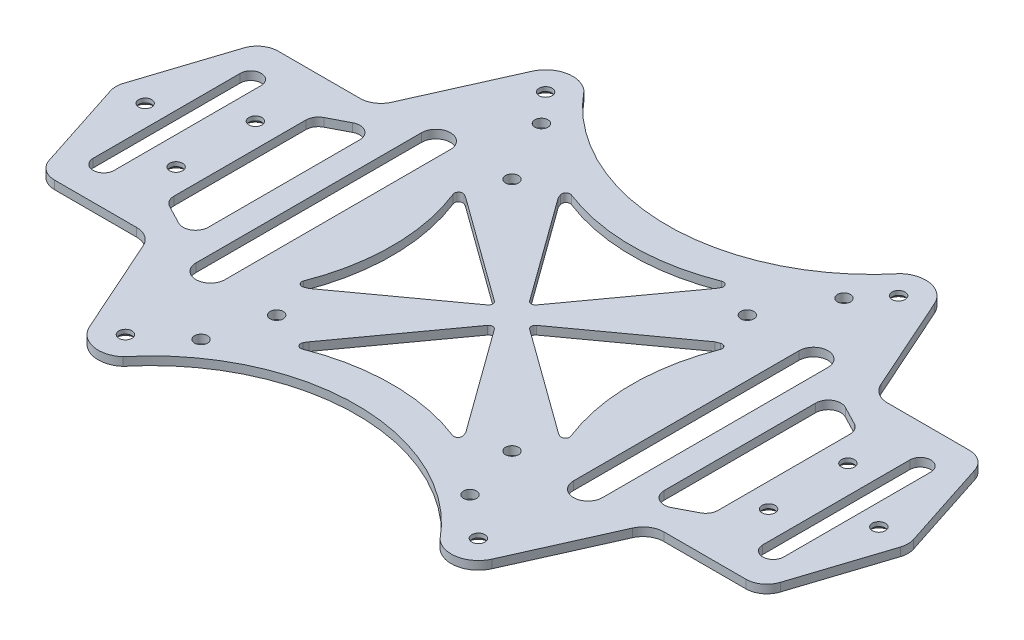
from build123d import *

# Parameters (mm, degrees)
SKETCH_1_R             = 1.55
EXTRUDE_1_DEPTH        = 2
CHAMFER_2_SIZE         = 1
CUT_EXTRUDE_4767_DEPTH = 111.105329369
FILLET_2_R             = 3
FILLET_3_R             = 5
FILLET_4_R             = 1


with BuildPart() as part:
    # 草图1 → 凸台-拉伸1 (new body)
    with BuildSketch(Plane(origin=(0, 0, 0), x_dir=(1, 0, 0), z_dir=(0, 1, 0))):
        with BuildLine():
            Line((47.899982554, 52.633397656), (59.52497064, 26.588251477))
            Line((59.52497064, 26.588251477), (85.869588061, 26.588251477))
            Line((85.869588061, 26.588251477), (94.505759306, 0))
            Line((94.505759306, 0), (85.869588061, -26.588251477))
            Line((85.869588061, -26.588251477), (59.52497064, -26.588251477))
            Line((59.52497064, -26.588251477), (47.899982554, -52.633397656))
            ThreePointArc((47.899982554, -52.633397656), (43.362068791, -56.315801292), (37.709796983, -54.831018053))
            ThreePointArc((37.709796983, -54.831018053), (0, -36.976547041), (-37.709796983, -54.831018053))
            ThreePointArc((-37.709796983, -54.831018053), (-43.362068791, -56.315801292), (-47.899982554, -52.633397656))
            Line((-47.899982554, -52.633397656), (-59.52497064, -26.588251477))
            Line((-59.52497064, -26.588251477), (-85.869588061, -26.588251477))
            Line((-85.869588061, -26.588251477), (-94.505759306, 0))
            Line((-94.505759306, 0), (-85.869588061, 26.588251477))
            Line((-85.869588061, 26.588251477), (-59.52497064, 26.588251477))
            Line((-59.52497064, 26.588251477), (-47.899982554, 52.633397656))
            ThreePointArc((-47.899982554, 52.633397656), (-43.362068791, 56.315801292), (-37.709796983, 54.831018053))
            ThreePointArc((-37.709796983, 54.831018053), (0, 36.976547041), (37.709796983, 54.831018053))
            ThreePointArc((37.709796983, 54.831018053), (43.362068791, 56.315801292), (47.899982554, 52.633397656))
        make_face()
        with Locations(Location((42, 50, 0), (0, 0, 270))):
            Circle(SKETCH_1_R, mode=Mode.SUBTRACT)
        with Locations(Location((42, -50, 0), (0, 0, 90))):
            Circle(SKETCH_1_R, mode=Mode.SUBTRACT)
        with Locations(Location((-42, -50, 0), (0, 0, 270))):
            Circle(SKETCH_1_R, mode=Mode.SUBTRACT)
        with Locations(Location((-42, 50, 0), (0, 0, 90))):
            Circle(SKETCH_1_R, mode=Mode.SUBTRACT)
        with Locations(Location((36, 43, 0), (0, 0, 270))):
            Circle(SKETCH_1_R, mode=Mode.SUBTRACT)
        with Locations(Location((32, -42, 0), (0, 0, 270))):
            Circle(SKETCH_1_R, mode=Mode.SUBTRACT)
        with Locations(Location((-32, -42, 0), (0, 0, 90))):
            Circle(SKETCH_1_R, mode=Mode.SUBTRACT)
        with Locations(Location((-36, 43, 0), (0, 0, 90))):
            Circle(SKETCH_1_R, mode=Mode.SUBTRACT)
        with Locations(Location((70.5, 9.435839055, 0), (0, 0, 270))):
            Circle(SKETCH_1_R, mode=Mode.SUBTRACT)
        with Locations(Location((70.5, -9.435839055, 0), (0, 0, 90))):
            Circle(SKETCH_1_R, mode=Mode.SUBTRACT)
        with Locations(Location((-70.5, -9.435839055, 0), (0, 0, 270))):
            Circle(SKETCH_1_R, mode=Mode.SUBTRACT)
        with Locations(Location((-70.5, 9.435839055, 0), (0, 0, 90))):
            Circle(SKETCH_1_R, mode=Mode.SUBTRACT)
        with Locations(Location((87.3, 0, 0), (0, 0, 270))):
            Circle(SKETCH_1_R, mode=Mode.SUBTRACT)
        with Locations(Location((-87.3, 0, 0), (0, 0, 90))):
            Circle(SKETCH_1_R, mode=Mode.SUBTRACT)
        with Locations(Location((28, 28, 0), (0, 0, 270))):
            Circle(SKETCH_1_R, mode=Mode.SUBTRACT)
        with Locations(Location((28, -28, 0), (0, 0, 270))):
            Circle(SKETCH_1_R, mode=Mode.SUBTRACT)
        with Locations(Location((-28, -28, 0), (0, 0, 270))):
            Circle(SKETCH_1_R, mode=Mode.SUBTRACT)
        with Locations(Location((-28, 28, 0), (0, 0, 270))):
            Circle(SKETCH_1_R, mode=Mode.SUBTRACT)
        with BuildLine():
            Line((77.169642998, -17.5), (77.169642998, 17.5))
            ThreePointArc((77.169642998, 17.5), (79.669642998, 20), (82.169642998, 17.5))
            Line((82.169642998, 17.5), (82.169642998, -17.5))
            ThreePointArc((82.169642998, -17.5), (79.669642998, -20), (77.169642998, -17.5))
        make_face(mode=Mode.SUBTRACT)
        with BuildLine():
            Line((-77.169642998, -17.5), (-77.169642998, 17.5))
            ThreePointArc((-77.169642998, 17.5), (-79.669642998, 20), (-82.169642998, 17.5))
            Line((-82.169642998, 17.5), (-82.169642998, -17.5))
            ThreePointArc((-82.169642998, -17.5), (-79.669642998, -20), (-77.169642998, -17.5))
        make_face(mode=Mode.SUBTRACT)
        with BuildLine():
            Line((-29.630231214, 18.644740495), (-3.891240241, 0))
            Line((-3.891240241, 0), (-29.630231214, -18.644740495))
            ThreePointArc((-29.630231214, -18.644740495), (-31.15278499, -19.235170637), (-32.699643644, -19.758626516))
            ThreePointArc((-32.699643644, -19.758626516), (-28.515989447, 0), (-32.699643644, 19.758626516))
            ThreePointArc((-32.699643644, 19.758626516), (-31.086798275, 19.417002923), (-29.630231214, 18.644740495))
        make_face(mode=Mode.SUBTRACT)
        with BuildLine():
            Line((18.644740495, 29.630231214), (0, 3.891240241))
            Line((0, 3.891240241), (-18.644740495, 29.630231214))
            ThreePointArc((-18.644740495, 29.630231214), (-19.235170637, 31.15278499), (-19.758626516, 32.699643644))
            ThreePointArc((-19.758626516, 32.699643644), (0, 28.515989447), (19.758626516, 32.699643644))
            ThreePointArc((19.758626516, 32.699643644), (19.417002923, 31.086798275), (18.644740495, 29.630231214))
        make_face(mode=Mode.SUBTRACT)
        with BuildLine():
            Line((29.630231214, -18.644740495), (3.891240241, 0))
            Line((3.891240241, 0), (29.630231214, 18.644740495))
            ThreePointArc((29.630231214, 18.644740495), (31.15278499, 19.235170637), (32.699643644, 19.758626516))
            ThreePointArc((32.699643644, 19.758626516), (28.515989447, 0), (32.699643644, -19.758626516))
            ThreePointArc((32.699643644, -19.758626516), (31.086798275, -19.417002923), (29.630231214, -18.644740495))
        make_face(mode=Mode.SUBTRACT)
        with BuildLine():
            Line((-18.644740495, -29.630231214), (0, -3.891240241))
            Line((0, -3.891240241), (18.644740495, -29.630231214))
            ThreePointArc((18.644740495, -29.630231214), (19.235170637, -31.15278499), (19.758626516, -32.699643644))
            ThreePointArc((19.758626516, -32.699643644), (0, -28.515989447), (-19.758626516, -32.699643644))
            ThreePointArc((-19.758626516, -32.699643644), (-19.417002923, -31.086798275), (-18.644740495, -29.630231214))
        make_face(mode=Mode.SUBTRACT)
        with BuildLine():
            Line((41.468701347, -26.829343455), (41.468701347, 26.829343455))
            ThreePointArc((41.468701347, 26.829343455), (44.919200659, 30.279842767), (48.36969997, 26.829343455))
            Line((48.36969997, 26.829343455), (48.36969997, -26.829343455))
            ThreePointArc((48.36969997, -26.829343455), (44.919200659, -30.279842767), (41.468701347, -26.829343455))
        make_face(mode=Mode.SUBTRACT)
        with BuildLine():
            Line((-41.468701347, -26.829343455), (-41.468701347, 26.829343455))
            ThreePointArc((-41.468701347, 26.829343455), (-44.919200659, 30.279842767), (-48.36969997, 26.829343455))
            Line((-48.36969997, 26.829343455), (-48.36969997, -26.829343455))
            ThreePointArc((-48.36969997, -26.829343455), (-44.919200659, -30.279842767), (-41.468701347, -26.829343455))
        make_face(mode=Mode.SUBTRACT)
    extrude(amount=EXTRUDE_1_DEPTH)

    # 倒角2
    chamfer_2_edges = [part.edges().sort_by_distance(p)[0] for p in [
        (70.5, 0, 10.985839055),
        (-70.5, 0, 7.885839055),
        (70.5, 0, -10.985839055),
        (-70.5, 0, -7.885839055),
        (87.3, 0, -1.55),
        (-87.3, 0, 1.55),
        (-42, 0, 48.45),
        (-42, 0, -48.45),
        (42, 0, -51.55),
        (42, 0, 51.55),
    ]]
    chamfer(chamfer_2_edges, length=CHAMFER_2_SIZE)

    # Sketch 4522 → Cut-Extrude 4767 (cut, through all)
    with BuildSketch(Plane.XZ):
        Polygon((-64.75, 17.5), (-54.25, 22.965954031), (-54.25, -22.965954031), (-64.75, -17.5), align=None)
        Polygon((54.25, -22.965954031), (64.75, -17.5), (64.75, 17.5), (54.25, 22.965954031), align=None)
    extrude(amount=-CUT_EXTRUDE_4767_DEPTH, mode=Mode.SUBTRACT)

    # 圆角2
    fillet_2_edges = [part.edges().sort_by_distance(p)[0] for p in [
        (-64.75, 1, -17.5),
        (-64.75, 1, 17.5),
        (-54.25, 1, 22.965954031),
        (-54.25, 1, -22.965954031),
        (54.25, 1, -22.965954031),
        (54.25, 1, 22.965954031),
        (64.75, 1, 17.5),
        (64.75, 1, -17.5),
    ]]
    fillet(fillet_2_edges, radius=FILLET_2_R)

    # 圆角3
    fillet_3_edges = [part.edges().sort_by_distance(p)[0] for p in [
        (59.52497064, 1, -26.588251477),
        (85.869588061, 1, -26.588251477),
        (94.505759306, 1, 0),
        (85.869588061, 1, 26.588251477),
        (59.52497064, 1, 26.588251477),
        (-59.52497064, 1, 26.588251477),
        (-85.869588061, 1, 26.588251477),
        (-94.505759306, 1, 0),
        (-85.869588061, 1, -26.588251477),
        (-59.52497064, 1, -26.588251477),
    ]]
    fillet(fillet_3_edges, radius=FILLET_3_R)

    # 圆角4
    fillet_4_edges = [part.edges().sort_by_distance(p)[0] for p in [
        (-32.699643644, 1, -19.758626516),
        (-32.699643644, 1, 19.758626516),
        (-3.891240241, 1, 0),
        (32.699643644, 1, 19.758626516),
        (32.699643644, 1, -19.758626516),
        (3.891240241, 1, 0),
        (-19.758626516, 1, 32.699643644),
        (19.758626516, 1, 32.699643644),
        (0, 1, 3.891240241),
        (19.758626516, 1, -32.699643644),
        (-19.758626516, 1, -32.699643644),
        (0, 1, -3.891240241),
    ]]
    fillet(fillet_4_edges, radius=FILLET_4_R)


solid = part.part
